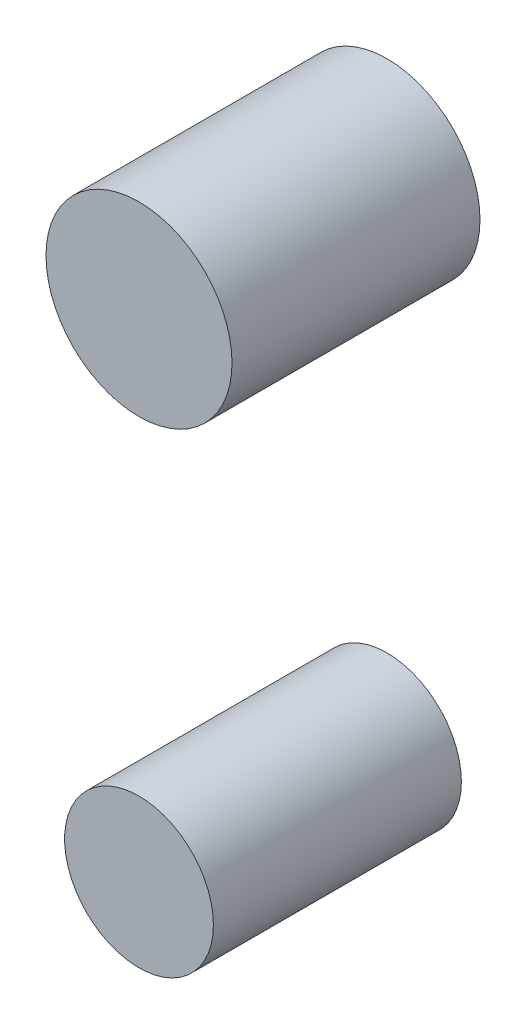
from build123d import *

# Parameters (mm, degrees)
BOSS_EXTRUDE1_DEPTH        = 20
BOSS_EXTRUDE1_DEPTH_BACK   = 20
SKETCH1_R                  = 12
BOSS_EXTRUDE1_2_DEPTH      = 20
BOSS_EXTRUDE1_2_DEPTH_BACK = 20
SKETCH1_R_2                = 15


with BuildPart() as part:
    # Sketch1 → Boss-Extrude1 (new, two sides: drawn at the far end of the back side and taken through both)
    with BuildSketch(Plane.XY.offset(-BOSS_EXTRUDE1_DEPTH_BACK)):
        Circle(SKETCH1_R)
    extrude(amount=BOSS_EXTRUDE1_DEPTH + BOSS_EXTRUDE1_DEPTH_BACK)


with BuildPart() as body_2:
    # Sketch1 → Boss-Extrude1 2 (new, two sides: drawn at the far end of the back side and taken through both)
    with BuildSketch(Plane.XY.offset(-BOSS_EXTRUDE1_2_DEPTH_BACK)):
        with Locations((0, 80)):
            Circle(SKETCH1_R_2)
    extrude(amount=BOSS_EXTRUDE1_2_DEPTH + BOSS_EXTRUDE1_2_DEPTH_BACK)


solid = Compound([part.part, body_2.part])
